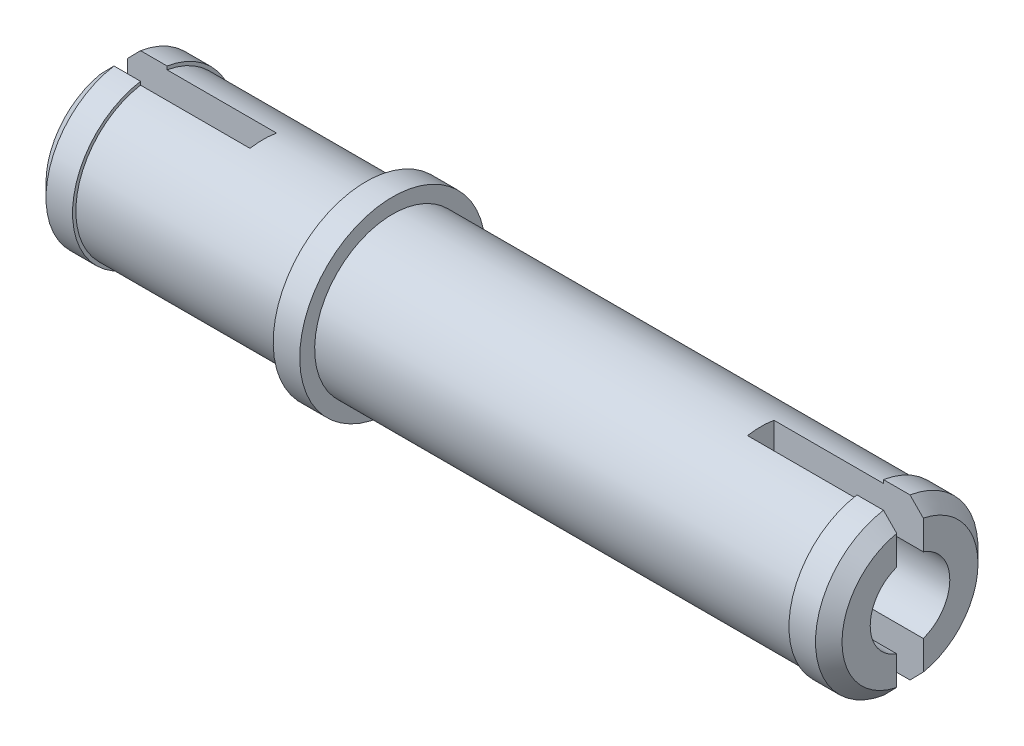
from build123d import *

# Parameters (mm, degrees)
CUT_EXTRUDE1_DEPTH      = 13.636455199
CUT_EXTRUDE1_DEPTH_BACK = 13.636455199
SKETCH2_W               = 7.322757876
SKETCH2_H               = 0.8
SKETCH2_W_2             = 6.557006547
CHAMFER1_SIZE           = 0.4
CUT_EXTRUDE2_DEPTH      = 25.324473273
CUT_EXTRUDE2_DEPTH_BACK = 25.324473273
SKETCH3_R               = 1.2


with BuildPart() as part:
    # Sketch1 → Revolve1 (revolve)
    with BuildSketch(Plane.XY, mode=Mode.PRIVATE) as revolve1_sk:
        Polygon((-12, 0), (12, 0), (12, 2.45), (10.8, 2.45), (10.8, 2.35), (-3.6, 2.35), (-3.6, 2.8), (-4.4, 2.8), (-4.4, 2.35), (-10.8, 2.35), (-10.8, 2.45), (-12, 2.45), align=None)
    revolve(revolve1_sk.sketch.rotate(Axis((-12, 0, 0), (1, 0, 0)), 180), axis=Axis((-12, 0, 0), (1, 0, 0)))

    # Sketch2 → Cut-Extrude1 (cut, two sides: drawn at the far end of the back side and taken through both)
    with BuildSketch(Plane(origin=(0, 0, 0), x_dir=(1, 0, 0), z_dir=(0, 1, 0)).offset(-CUT_EXTRUDE1_DEPTH_BACK)):
        with Locations((-11.161378938, 0)):
            Rectangle(SKETCH2_W, SKETCH2_H)
        with Locations((10.778503274, 0)):
            Rectangle(SKETCH2_W_2, SKETCH2_H)
    extrude(amount=CUT_EXTRUDE1_DEPTH + CUT_EXTRUDE1_DEPTH_BACK, mode=Mode.SUBTRACT)

    # Chamfer1
    chamfer1_edges = [part.edges().sort_by_distance(p)[0] for p in [
        (-12, 0, 2.45),
        (12, 0, 2.45),
        (-12, 0, -2.45),
        (12, 0, -2.45),
    ]]
    chamfer(chamfer1_edges, length=CHAMFER1_SIZE)

    # Sketch3 → Cut-Extrude2 (cut, two sides: drawn at the far end of the back side and taken through both)
    with BuildSketch(Plane(origin=(12, 0, 0), x_dir=(0, 0, -1), z_dir=(1, 0, 0)).offset(-CUT_EXTRUDE2_DEPTH_BACK)):
        with Locations(Location((0, 0, 0), (0, 0, 289.471220634))):
            Circle(SKETCH3_R)
    extrude(amount=CUT_EXTRUDE2_DEPTH + CUT_EXTRUDE2_DEPTH_BACK, mode=Mode.SUBTRACT)


solid = part.part
